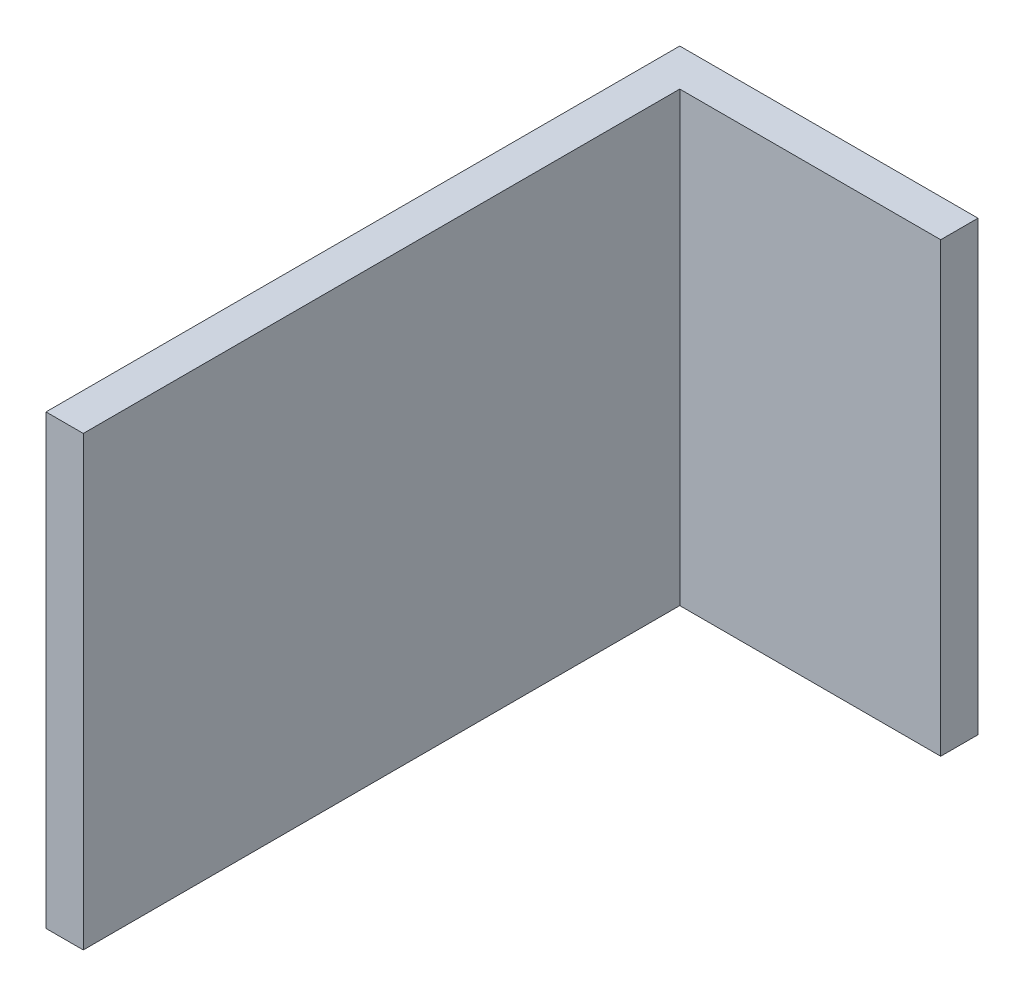
from build123d import *

# Parameters (mm, degrees)
SKETCH1_W           = 25.4
SKETCH1_H           = 38.1
BOSS_EXTRUDE1_DEPTH = 3.175
SKETCH2_W           = 3.175
SKETCH2_H           = 38.1
BOSS_EXTRUDE2_DEPTH = 50.8


with BuildPart() as part:
    # Sketch1 → Boss-Extrude1 (new body)
    with BuildSketch(Plane.XY):
        with Locations((12.7, 19.05)):
            Rectangle(SKETCH1_W, SKETCH1_H)
    extrude(amount=BOSS_EXTRUDE1_DEPTH)

    # Sketch2 → Boss-Extrude2 (add)
    with BuildSketch(Plane.XY.offset(3.175)):
        with Locations((1.5875, 19.05)):
            Rectangle(SKETCH2_W, SKETCH2_H)
    extrude(amount=BOSS_EXTRUDE2_DEPTH)


solid = part.part
